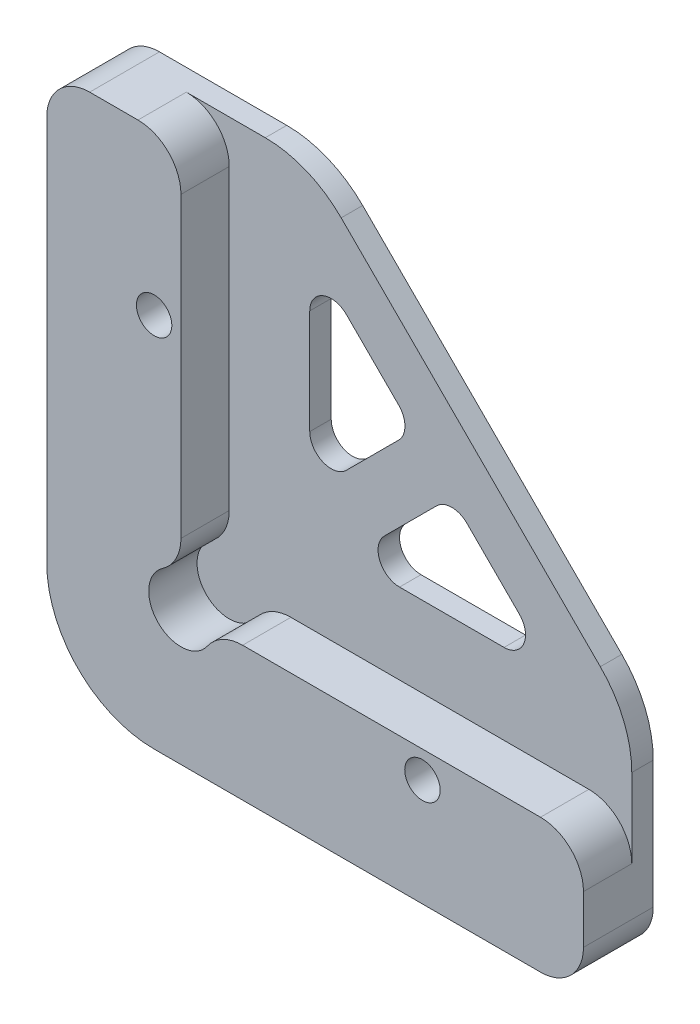
from build123d import *

# Parameters (mm, degrees)
SKETCH1_W           = 12.5
SKETCH1_H           = 30
SKETCH1_R           = 1.65
SKETCH1_W_2         = 30
SKETCH1_H_2         = 12.5
BOSS_EXTRUDE1_DEPTH = 6.5
SKETCH1_3_W         = 7.5
SKETCH1_3_H         = 30
SKETCH1_3_H_2       = 7.5
SKETCH1_3_W_2       = 30
BOSS_EXTRUDE2_DEPTH = 2
FILLET1_R           = 10
FILLET2_R           = 4
SKETCH2_R           = 3
CUT_EXTRUDE1_DEPTH  = 4.5
FILLET3_R           = 4
CUT_EXTRUDE2_DEPTH  = 2
FILLET4_R           = 2


with BuildPart() as part:
    # Sketch1 → Boss-Extrude1 (new body)
    # profile 1 of 3: a face of its own
    with BuildSketch(Plane.XY):
        with Locations((-13.75, 15)):
            Rectangle(SKETCH1_W, SKETCH1_H)
        with Locations(Location((-10, 15, 0), (0, 0, 180))):
            Circle(SKETCH1_R, mode=Mode.SUBTRACT)
    # profile 2 of 3: a face of its own
    with BuildSketch(Plane.XY):
        with BuildLine():
            Line((-7.5, 0), (-20, 0))
            Line((-20, 0), (-20, -10))
            ThreePointArc((-20, -10), (-17.071067812, -17.071067812), (-10, -20))
            Line((-10, -20), (0, -20))
            Line((0, -20), (0, -7.5))
            Line((0, -7.5), (-7.5, -7.5))
            Line((-7.5, -7.5), (-7.5, 0))
        make_face()
    # profile 3 of 3: a face of its own
    with BuildSketch(Plane.XY):
        with Locations((15, -13.75)):
            Rectangle(SKETCH1_W_2, SKETCH1_H_2)
        with Locations(Location((15, -10, 0), (0, 0, 180))):
            Circle(SKETCH1_R, mode=Mode.SUBTRACT)
    extrude(amount=BOSS_EXTRUDE1_DEPTH)

    # Sketch1<3> → Boss-Extrude2 (add)
    with BuildSketch(Plane.XY):
        with Locations((-3.75, 15)):
            Rectangle(SKETCH1_3_W, SKETCH1_3_H)
        with Locations((-3.75, -3.75)):
            Rectangle(SKETCH1_3_W, SKETCH1_3_H_2)
        with Locations((15, -3.75)):
            Rectangle(SKETCH1_3_W_2, SKETCH1_3_H_2)
        Polygon((0, 30), (30, 0), (0, 0), align=None)
    extrude(amount=BOSS_EXTRUDE2_DEPTH)

    # Fillet1
    fillet1_edges = [part.edges().sort_by_distance(p)[0] for p in [
        (30, 0, 1),
        (0, 30, 1),
    ]]
    fillet(fillet1_edges, radius=FILLET1_R)

    # Fillet2
    fillet2_edges = [part.edges().sort_by_distance(p)[0] for p in [
        (-20, 30, 3.25),
        (-7.5, 30, 4.25),
        (30, -7.5, 4.25),
        (30, -20, 3.25),
    ]]
    fillet(fillet2_edges, radius=FILLET2_R)

    # Sketch2 → Cut-Extrude1 (cut)
    with BuildSketch(Plane.XY.offset(6.5)):
        with Locations((-7.5, -7.5)):
            Circle(SKETCH2_R)
    extrude(amount=-CUT_EXTRUDE1_DEPTH, mode=Mode.SUBTRACT)

    # Fillet3
    fillet3_edges = [part.edges().sort_by_distance(p)[0] for p in [
        (-4.5, -7.5, 4.25),
        (-7.5, -4.5, 4.25),
    ]]
    fillet(fillet3_edges, radius=FILLET3_R)

    # Sketch3 → Cut-Extrude2 (cut)
    with BuildSketch(Plane.XY.offset(2)):
        Polygon((3.535533906, 0), (22.928932188, 0), (13.232233047, 9.696699141), align=None)
        Polygon((0, 22.928932188), (0, 3.535533906), (9.696699141, 13.232233047), align=None)
    extrude(amount=-CUT_EXTRUDE2_DEPTH, mode=Mode.SUBTRACT)

    # Fillet4
    fillet4_edges = [part.edges().sort_by_distance(p)[0] for p in [
        (0, 22.928932188, 1),
        (9.696699141, 13.232233047, 1),
        (0, 3.535533906, 1),
        (13.232233047, 9.696699141, 1),
        (22.928932188, 0, 1),
        (3.535533906, 0, 1),
    ]]
    fillet(fillet4_edges, radius=FILLET4_R)


solid = part.part
